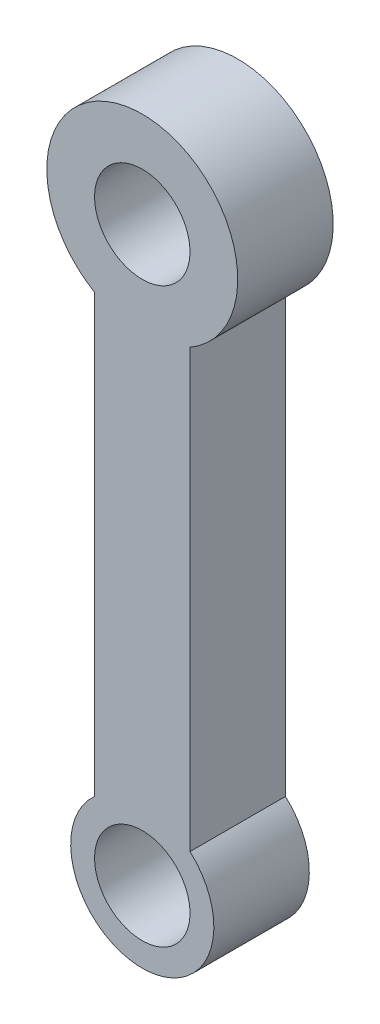
from build123d import *

# Parameters (mm, degrees)
BOSS_EXTRUDE1_DEPTH = 20
SKETCH2_R           = 10
CUT_EXTRUDE3_DEPTH  = 20


with BuildPart() as part:
    # Sketch1 → Boss-Extrude1 (new body)
    with BuildSketch(Plane.XY):
        with BuildLine():
            Line((10, -63.12184827), (10, 28.377303767))
            ThreePointArc((10, 28.377303767), (0, 65.697811843), (-10, 28.377303767))
            Line((-10, 28.377303767), (-10, -63.12184827))
            ThreePointArc((-10, -63.12184827), (0, -89.302188157), (10, -63.12184827))
        make_face()
    extrude(amount=BOSS_EXTRUDE1_DEPTH)

    # Sketch2 → Cut-Extrude3 (cut)
    with BuildSketch(Plane(origin=(0, 0, 0), x_dir=(-1, 0, 0), z_dir=(0, 0, -1))):
        with Locations((0, 45.697811843)):
            Circle(SKETCH2_R)
        with Locations((0, -74.302188157)):
            Circle(SKETCH2_R)
    extrude(amount=-CUT_EXTRUDE3_DEPTH, mode=Mode.SUBTRACT)


solid = part.part
